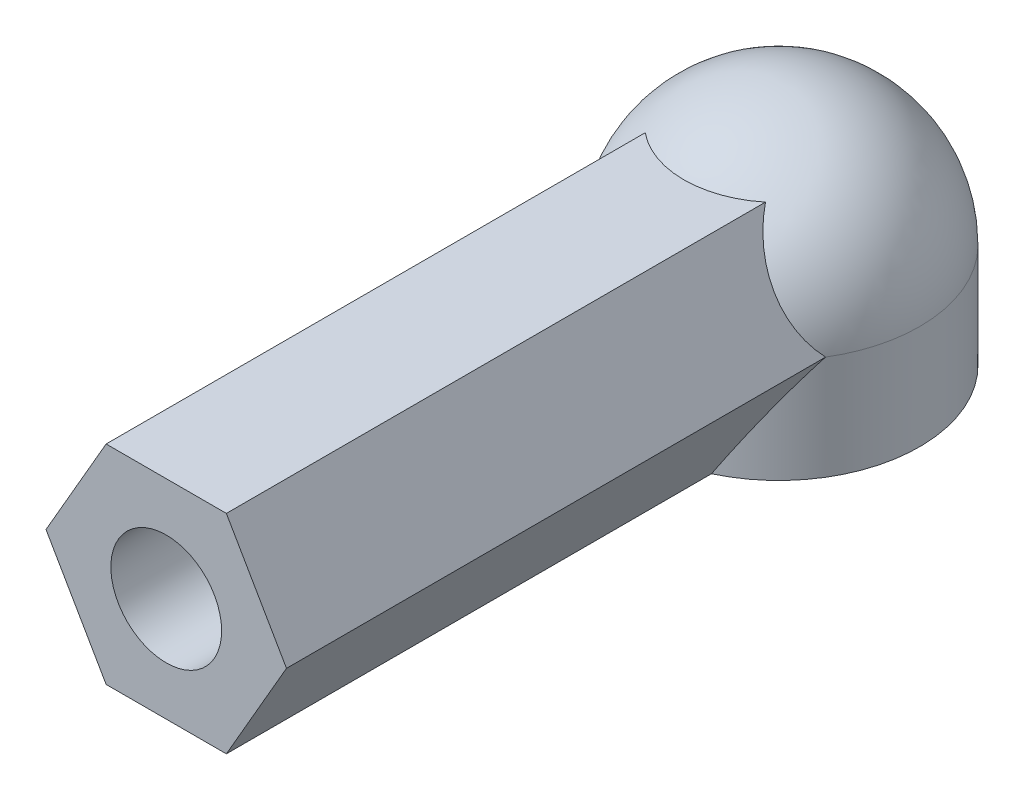
from build123d import *

# Parameters (mm, degrees)
BOSS_EXTRUDE1_DEPTH       = 12.5
F_4_40_TAPPED_HOLE1_D     = 2.2606
F_4_40_TAPPED_HOLE1_DEPTH = 12
F_4_40_TAPPED_HOLE1_TIP   = 0.679152758
CHAMFER1_SIZE             = 0.375


with BuildPart() as part:
    # Sketch1 → Revolve1 (revolve)
    with BuildSketch(Plane.XY):
        with BuildLine():
            Line((2.875, 2.125), (2.875, 0))
            Line((2.875, 0), (0, 0))
            Line((0, 0), (0, 5))
            ThreePointArc((0, 5), (2.032931996, 4.157931996), (2.875, 2.125))
        make_face()
    revolve(axis=Axis((0, 0, 0), (0, 1, 0)))

    # Sketch2 → Boss-Extrude1 (add)
    with BuildSketch(Plane.XY):
        Polygon((-1.226869322, 0), (1.226869322, 0), (2.453738644, 2.125), (1.226869322, 4.25), (-1.226869322, 4.25), (-2.453738644, 2.125), align=None)
    extrude(amount=BOSS_EXTRUDE1_DEPTH)

    # #4-40 Tapped Hole1
    with Locations(Plane.XY.offset(12.5)):
        with Locations((0, 2.125)):
            Hole(F_4_40_TAPPED_HOLE1_D / 2, depth=F_4_40_TAPPED_HOLE1_DEPTH)
            with Locations((0, 0, -(F_4_40_TAPPED_HOLE1_DEPTH + F_4_40_TAPPED_HOLE1_TIP / 2))):  # 118° drill point
                Cone(0, F_4_40_TAPPED_HOLE1_D / 2, F_4_40_TAPPED_HOLE1_TIP, mode=Mode.SUBTRACT)

    # Sketch5 → Cut-Revolve1 (revolve, cut)
    with BuildSketch(Plane(origin=(0, 0, 0), x_dir=(0, 0, -1), z_dir=(1, 0, 0))):
        with BuildLine():
            Line((2.1, 2.125), (2.1, 0))
            Line((2.1, 0), (0, 0))
            Line((0, 0), (0, 4.225))
            ThreePointArc((0, 4.225), (1.48492424, 3.60992424), (2.1, 2.125))
        make_face()
    revolve(axis=Axis((0, 0, 0), (0, 1, 0)), mode=Mode.SUBTRACT)

    # Chamfer1
    chamfer1_edges = [part.edges().sort_by_distance(p)[0] for p in [
        (0, 0, 2.1),
    ]]
    chamfer(chamfer1_edges, length=CHAMFER1_SIZE)


solid = part.part
